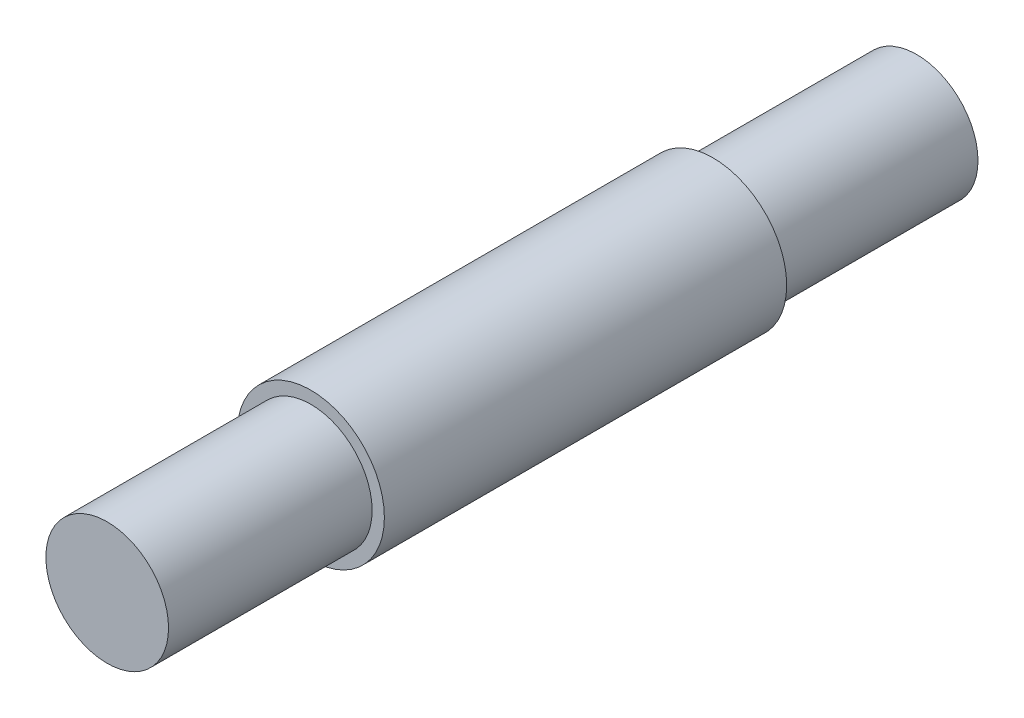
from build123d import *

# Parameters (mm, degrees)
SKETCH2_R           = 25
BOSS_EXTRUDE1_DEPTH = 83
SKETCH3_R           = 30
BOSS_EXTRUDE2_DEPTH = 164
SKETCH4_R           = 25
BOSS_EXTRUDE3_DEPTH = 83


with BuildPart() as part:
    # Sketch2 → Boss-Extrude1 (new body)
    with BuildSketch(Plane.XY):
        Circle(SKETCH2_R)
    extrude(amount=BOSS_EXTRUDE1_DEPTH)

    # Sketch3 → Boss-Extrude2 (add)
    with BuildSketch(Plane.XY.offset(83)):
        Circle(SKETCH3_R)
    extrude(amount=BOSS_EXTRUDE2_DEPTH)

    # Sketch4 → Boss-Extrude3 (add)
    with BuildSketch(Plane.XY.offset(247)):
        Circle(SKETCH4_R)
    extrude(amount=BOSS_EXTRUDE3_DEPTH)


solid = part.part
